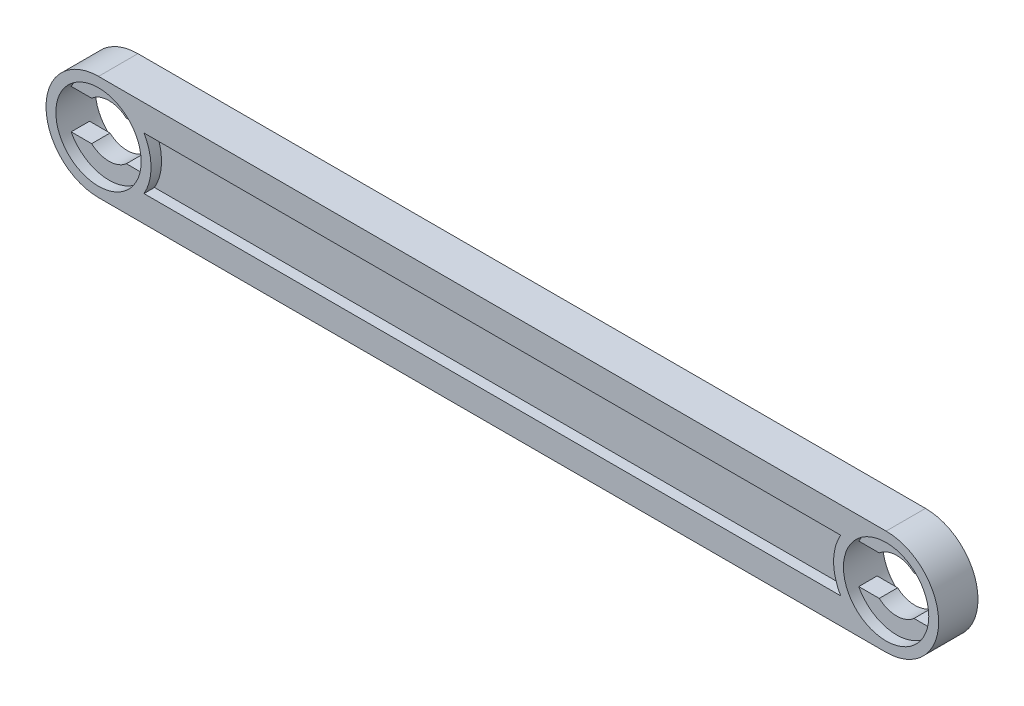
from build123d import *

# Parameters (mm, degrees)
EXTRUDE_1_DEPTH     = 3
CUT_EXTRUDE_1_REACH = 66.195
SKETCH_3_R          = 3.25
CUT_EXTRUDE_2_DEPTH = 0.8
CUT_EXTRUDE_START   = -2.2
SKETCH_3_2_R        = 3.25
CUT_EXTRUDE_3_DEPTH = 0.8
CUT_EXTRUDE_4_DEPTH = 0.8
SKETCH_5_W          = 52
SKETCH_5_H          = 4
CUT_EXTRUDE_5_DEPTH = 0.8


with BuildPart() as part:
    # 草图1 → 凸台-拉伸1 (new body)
    with BuildSketch(Plane.XY):
        with BuildLine():
            Line((0, 4), (60, 4))
            ThreePointArc((60, 4), (64, 0), (60, -4))
            Line((60, -4), (0, -4))
            ThreePointArc((0, -4), (-4, 0), (0, 4))
        make_face()
    extrude(amount=-EXTRUDE_1_DEPTH)

    # 草图2 → 切除-拉伸1 (cut, up to next)
    with BuildSketch(Plane.XY, mode=Mode.PRIVATE) as cut_extrude_1_sk1:
        with BuildLine():
            Line((1.322875656, -1.5), (2.883140649, -1.5))
            ThreePointArc((2.883140649, -1.5), (3.25, 0), (2.883140649, 1.5))
            Line((2.883140649, 1.5), (1.322875656, 1.5))
            ThreePointArc((1.322875656, 1.5), (0, 2), (-1.322875656, 1.5))
            Line((-1.322875656, 1.5), (-2.883140649, 1.5))
            ThreePointArc((-2.883140649, 1.5), (-3.25, 0), (-2.883140649, -1.5))
            Line((-2.883140649, -1.5), (-1.322875656, -1.5))
            ThreePointArc((-1.322875656, -1.5), (0, -2), (1.322875656, -1.5))
        make_face()
    cut_extrude_1_tool1 = extrude(cut_extrude_1_sk1.sketch, amount=-CUT_EXTRUDE_1_REACH, mode=Mode.PRIVATE) & part.part
    cut_extrude_1 = cut_extrude_1_tool1.solids().sort_by_distance((0, 0, 0))[0]
    add(cut_extrude_1, mode=Mode.SUBTRACT)

    # 草图3 → 切除-拉伸2 (cut)
    with BuildSketch(Plane.XY):
        Circle(SKETCH_3_R)
    cut_extrude_2 = extrude(amount=-CUT_EXTRUDE_2_DEPTH, mode=Mode.SUBTRACT)

    # 草图3<2> → 切除-拉伸3 (cut)
    with BuildSketch(Plane.XY.offset(CUT_EXTRUDE_START)):
        Circle(SKETCH_3_2_R)
    cut_extrude_3 = extrude(amount=-CUT_EXTRUDE_3_DEPTH, mode=Mode.SUBTRACT)

    # 镜向1: 切除-拉伸1, 切除-拉伸2, 切除-拉伸3 across plane
    add(cut_extrude_1.mirror(Plane(origin=(30, 0, 0), x_dir=(0, 0, 1), z_dir=(1, 0, 0))), mode=Mode.SUBTRACT)
    add(cut_extrude_2.mirror(Plane(origin=(30, 0, 0), x_dir=(0, 0, 1), z_dir=(1, 0, 0))), mode=Mode.SUBTRACT)
    add(cut_extrude_3.mirror(Plane(origin=(30, 0, 0), x_dir=(0, 0, 1), z_dir=(1, 0, 0))), mode=Mode.SUBTRACT)

    # 草图4 → 切除-拉伸4 (cut)
    with BuildSketch(Plane.XY):
        with BuildLine():
            Line((3.464101615, 2), (56.535898385, 2))
            ThreePointArc((56.535898385, 2), (56, 0), (56.535898385, -2))
            Line((56.535898385, -2), (3.464101615, -2))
            ThreePointArc((3.464101615, -2), (4, 0), (3.464101615, 2))
        make_face()
    extrude(amount=-CUT_EXTRUDE_4_DEPTH, mode=Mode.SUBTRACT)

    # 草图5 → 切除-拉伸5 (cut)
    with BuildSketch(Plane(origin=(0, 0, -3), x_dir=(-1, 0, 0), z_dir=(0, 0, -1))):
        with Locations((-30, 0)):
            Rectangle(SKETCH_5_W, SKETCH_5_H)
    extrude(amount=-CUT_EXTRUDE_5_DEPTH, mode=Mode.SUBTRACT)


solid = part.part
